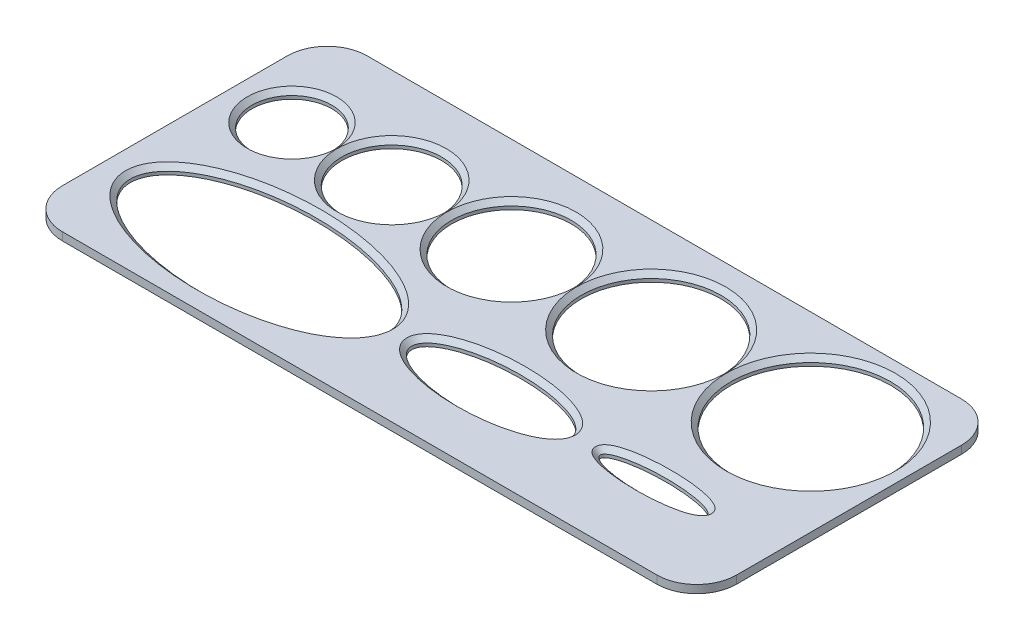
from build123d import *

# Parameters (mm, degrees)
SKETCH1_R           = 10
SKETCH1_R_2         = 12.5
SKETCH1_R_3         = 15
SKETCH1_R_4         = 17.5
SKETCH1_R_5         = 20
SKETCH1_RX          = 32.743853127
SKETCH1_RY          = 15.28219651
SKETCH1_RX_2        = 19.895942638
SKETCH1_RY_2        = 7.410554201
SKETCH1_RX_3        = 13.340096181
SKETCH1_RY_3        = 3.178438996
BOSS_EXTRUDE1_DEPTH = 2
CHAMFER1_SIZE       = 1.2


with BuildPart() as part:
    # Sketch1 → Boss-Extrude1 (new body)
    with BuildSketch(Plane(origin=(0, 0, 0), x_dir=(1, 0, 0), z_dir=(0, 1, 0))):
        with BuildLine():
            Line((104.360328165, 41.874385695), (-44.558327228, 41.874385695))
            ThreePointArc((-44.558327228, 41.874385695), (-51.62939504, 38.945453507), (-54.558327228, 31.874385695))
            Line((-54.558327228, 31.874385695), (-54.558327228, -24.473029172))
            ThreePointArc((-54.558327228, -24.473029172), (-51.62939504, -31.544096984), (-44.558327228, -34.473029172))
            Line((-44.558327228, -34.473029172), (104.360328165, -34.473029172))
            ThreePointArc((104.360328165, -34.473029172), (111.431395977, -31.544096984), (114.360328165, -24.473029172))
            Line((114.360328165, -24.473029172), (114.360328165, 31.874385695))
            ThreePointArc((114.360328165, 31.874385695), (111.431395977, 38.945453507), (104.360328165, 41.874385695))
        make_face()
        with Locations(Location((-39.497024424, 17.963335967, 0), (0, 0, 270))):
            Circle(SKETCH1_R, mode=Mode.SUBTRACT)
        with Locations(Location((-14.497024424, 17.963335967, 0), (0, 0, 270))):
            Circle(SKETCH1_R_2, mode=Mode.SUBTRACT)
        with Locations(Location((15.502975576, 17.963335967, 0), (0, 0, 270))):
            Circle(SKETCH1_R_3, mode=Mode.SUBTRACT)
        with Locations(Location((50.502975576, 17.963335967, 0), (0, 0, 270))):
            Circle(SKETCH1_R_4, mode=Mode.SUBTRACT)
        with Locations(Location((90.502975576, 17.963335967, 0), (0, 0, 270))):
            Circle(SKETCH1_R_5, mode=Mode.SUBTRACT)
        with Locations(Location((-15.967241465, -13.751099436), (0, 0, -1.014060982))):
            Ellipse(SKETCH1_RX, SKETCH1_RY, mode=Mode.SUBTRACT)
        with Locations(Location((42.696291751, -14.330592911), (0, 0, 0))):
            Ellipse(SKETCH1_RX_2, SKETCH1_RY_2, mode=Mode.SUBTRACT)
        with Locations(Location((83.377613056, -14.330592911), (0, 0, 180))):
            Ellipse(SKETCH1_RX_3, SKETCH1_RY_3, mode=Mode.SUBTRACT)
    extrude(amount=BOSS_EXTRUDE1_DEPTH)

    # Chamfer1
    chamfer1_edges = [part.edges().sort_by_distance(p)[0] for p in [
        (-39.497024424, 2, -27.963335967),
        (-14.497024424, 2, -30.463335967),
        (15.502975576, 2, -32.963335967),
        (50.502975576, 2, -35.463335967),
        (90.502975576, 2, -37.963335967),
        (-48.707079481, 2, 13.305388474),
        (96.685374341, 2, 14.109425159),
        (22.804693335, 2, 14.485444524),
    ]]
    chamfer(chamfer1_edges, length=CHAMFER1_SIZE)


solid = part.part
